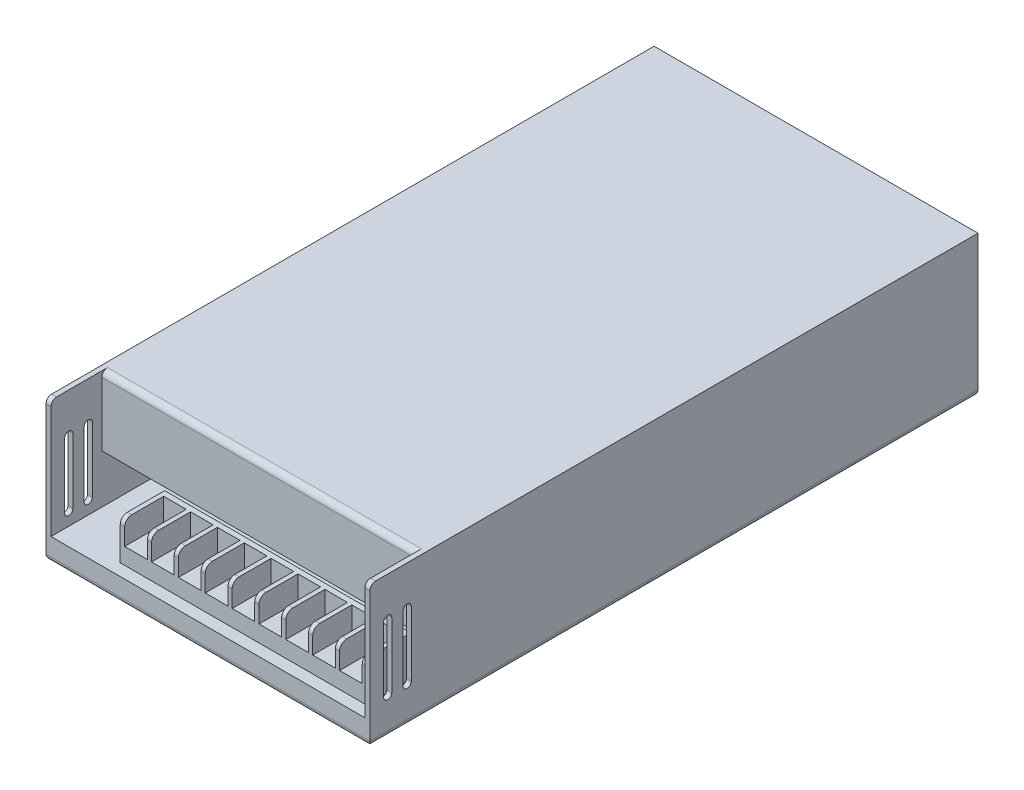
from build123d import *

# Parameters (mm, degrees)
BOSS_EXTRUDE1_DEPTH      = 41.75
BOSS_EXTRUDE1_DEPTH_BACK = 8.25
SKETCH1_W                = 114.5
SKETCH1_H                = 215
SKETCH2_W                = 111
SKETCH2_H                = 41.75
CUT_EXTRUDE1_DEPTH       = 18
CUT_EXTRUDE2_DEPTH       = 232.651273469
FILLET1_R                = 2
SKETCH4_W                = 87.05
SKETCH4_H                = 13.8
BOSS_EXTRUDE2_DEPTH      = 14.25
SKETCH7_W                = 111
SKETCH7_H                = 17.25
CUT_EXTRUDE4_DEPTH       = 195.25
FILLET2_R                = 2.5
CUT_EXTRUDE3_START       = -13.8
SKETCH6_W                = 8
SKETCH6_H                = 8.45
CUT_EXTRUDE3_DEPTH       = 13.8
SKETCH9_W                = 87.05
SKETCH9_H                = 13.75
BOSS_EXTRUDE6_DEPTH      = 1.9
LPATTERN1_COUNT          = 9
LPATTERN1_PITCH          = 9.5


with BuildPart() as part:
    # Sketch1 → Boss-Extrude1 (new, two sides: drawn at the far end of the back side and taken through both)
    with BuildSketch(Plane(origin=(0, 0, 0), x_dir=(1, 0, 0), z_dir=(0, 1, 0)).offset(-BOSS_EXTRUDE1_DEPTH_BACK)):
        with Locations((0, 89.5)):
            Rectangle(SKETCH1_W, SKETCH1_H)
    extrude(amount=BOSS_EXTRUDE1_DEPTH + BOSS_EXTRUDE1_DEPTH_BACK)

    # Sketch2 → Cut-Extrude1 (cut)
    with BuildSketch(Plane.XY.offset(18)):
        with Locations((0, 20.875)):
            Rectangle(SKETCH2_W, SKETCH2_H)
    extrude(amount=-CUT_EXTRUDE1_DEPTH, mode=Mode.SUBTRACT)

    # Sketch3 → Cut-Extrude2 (cut, through all)
    with BuildSketch(Plane(origin=(57.25, 0, 0), x_dir=(0, 0, -1), z_dir=(1, 0, 0))):
        with BuildLine():
            Line((-10.26, 27.7), (-10.26, 4.7))
            ThreePointArc((-10.26, 4.7), (-11.71, 3.25), (-13.16, 4.7))
            Line((-13.16, 4.7), (-13.16, 27.7))
            ThreePointArc((-13.16, 27.7), (-11.71, 29.15), (-10.26, 27.7))
        make_face()
        with BuildLine():
            Line((-3.36, 27.7), (-3.36, 4.7))
            ThreePointArc((-3.36, 4.7), (-4.81, 3.25), (-6.26, 4.7))
            Line((-6.26, 4.7), (-6.26, 27.7))
            ThreePointArc((-6.26, 27.7), (-4.81, 29.15), (-3.36, 27.7))
        make_face()
    extrude(amount=-CUT_EXTRUDE2_DEPTH, mode=Mode.SUBTRACT)

    # Fillet1
    fillet1_edges = [part.edges().sort_by_distance(p)[0] for p in [
        (57.25, -8.25, -89.5),
        (-56.375, 41.75, 18),
        (0, -8.25, -197),
        (56.375, 41.75, 18),
        (0, 41.75, 0),
        (-57.25, -8.25, -89.5),
        (0, -8.25, 18),
    ]]
    fillet(fillet1_edges, radius=FILLET1_R)

    # Sketch7 → Cut-Extrude4 (cut)
    with BuildSketch(Plane.XY):
        with Locations((0, 8.625)):
            Rectangle(SKETCH7_W, SKETCH7_H)
    extrude(amount=-CUT_EXTRUDE4_DEPTH, mode=Mode.SUBTRACT)


with BuildPart() as body_2:
    # Sketch4 → Boss-Extrude2 (new body)
    with BuildSketch(Plane(origin=(0, 0, 0), x_dir=(-1, 0, 0), z_dir=(0, 1, 0))):
        with Locations((-8.325, 6.9)):
            Rectangle(SKETCH4_W, SKETCH4_H)
    extrude(amount=BOSS_EXTRUDE2_DEPTH)

    # Fillet2
    fillet2_edges = [body_2.edges().sort_by_distance(p)[0] for p in [
        (8.325, 14.25, 13.8),
    ]]
    fillet(fillet2_edges, radius=FILLET2_R)

    # Sketch6 → Cut-Extrude3 (cut)
    with BuildSketch(Plane.XY.offset(13.8).offset(CUT_EXTRUDE3_START)):
        with Locations((46.35, 10.025)):
            Rectangle(SKETCH6_W, SKETCH6_H)
    cut_extrude3 = extrude(amount=CUT_EXTRUDE3_DEPTH, mode=Mode.SUBTRACT)

    # Sketch9 → Boss-Extrude6 (add)
    with BuildSketch(Plane(origin=(0, 0, 0), x_dir=(-1, 0, 0), z_dir=(0, 0, -1))):
        with Locations((-8.325, 7.375)):
            Rectangle(SKETCH9_W, SKETCH9_H)
    extrude(amount=BOSS_EXTRUDE6_DEPTH)

    # LPattern1: Cut-Extrude3 ×9
    with Locations(*[(-i * LPATTERN1_PITCH, 0, 0) for i in range(1, LPATTERN1_COUNT)]):
        add(cut_extrude3, mode=Mode.SUBTRACT)


solid = Compound([part.part, body_2.part])
